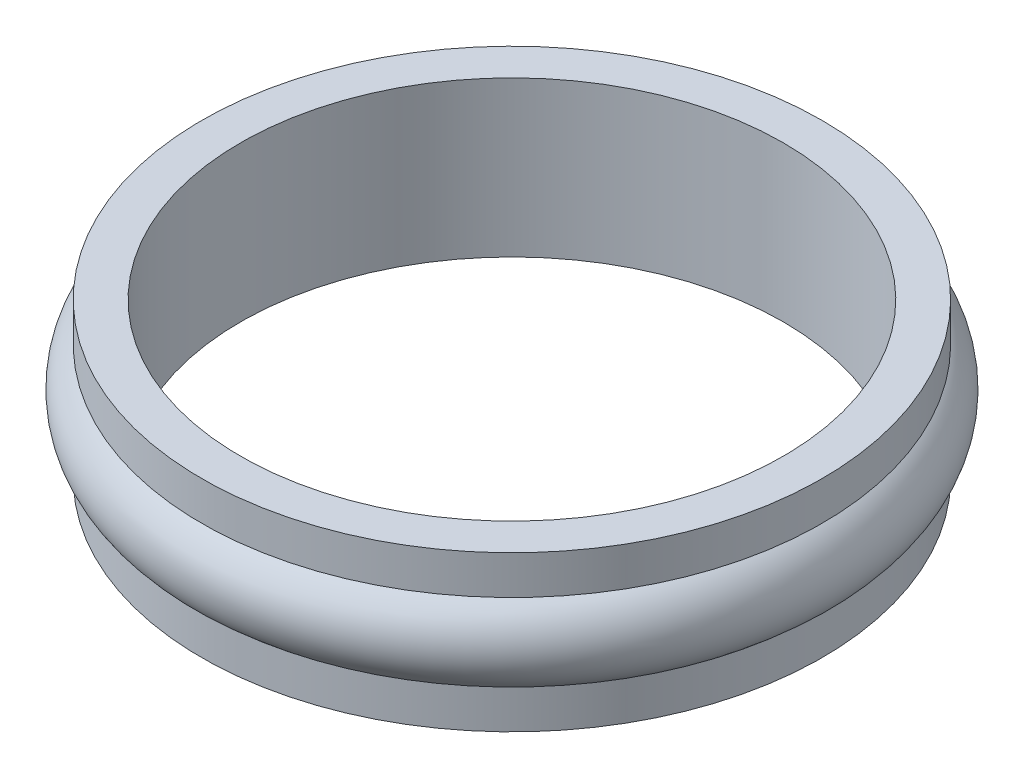
from build123d import *


with BuildPart() as part:
    # Sketch3 → Revolve3 (revolve)
    with BuildSketch(Plane.XY, mode=Mode.PRIVATE) as revolve3_sk:
        with BuildLine():
            Line((25.4, 0), (22.225, 0))
            Line((22.225, 0), (22.225, 12.7))
            Line((22.225, 12.7), (25.4, 12.7))
            Line((25.4, 12.7), (25.4, 9.525))
            ThreePointArc((25.4, 9.525), (26.9875, 6.35), (25.4, 3.175))
            Line((25.4, 3.175), (25.4, 0))
        make_face()
    revolve(revolve3_sk.sketch.rotate(Axis((0, 0, 0), (0, 1, 0)), 90), axis=Axis((0, 0, 0), (0, 1, 0)))


solid = part.part
